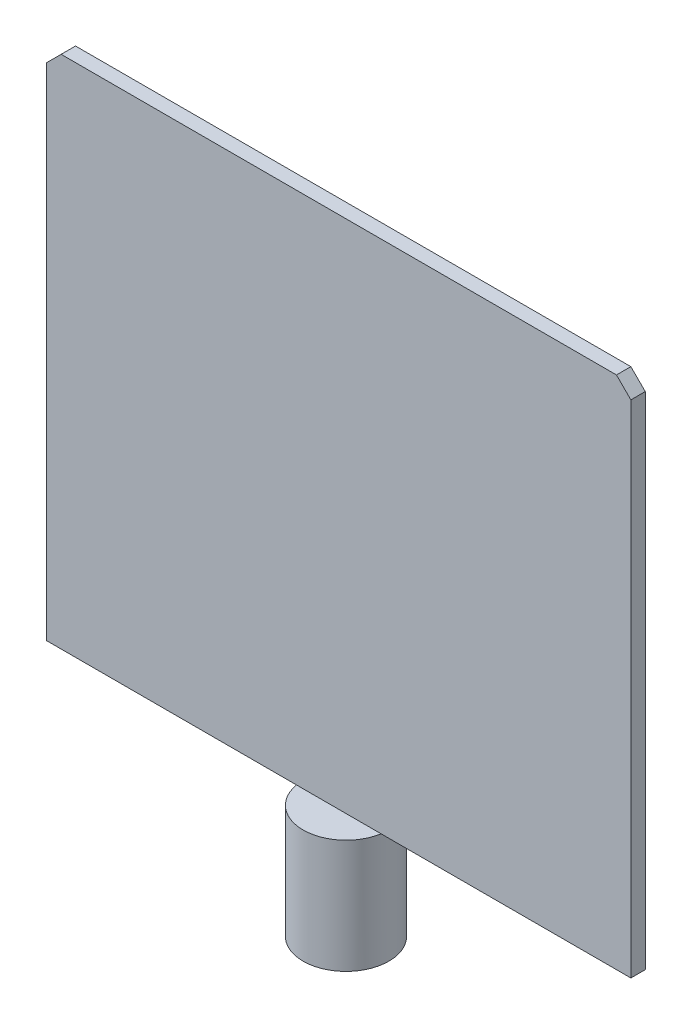
from build123d import *

# Parameters (mm, degrees)
ESQUISSE2_R             = 2.98
BOSS_EXTRU_1_DEPTH      = 7.9
BOSS_EXTRU_2_DEPTH      = 0.5
BOSS_EXTRU_2_DEPTH_BACK = 0.5
ESQUISSE3_W             = 40.6
ESQUISSE3_H             = 35.8
CHANFREIN1_SIZE         = 1


with BuildPart() as part:
    # Esquisse2 → Boss.-Extru.1 (new body)
    with BuildSketch(Plane(origin=(0, 0, 0), x_dir=(1, 0, 0), z_dir=(0, 1, 0))):
        Circle(ESQUISSE2_R)
    extrude(amount=-BOSS_EXTRU_1_DEPTH)

    # Esquisse3 → Boss.-Extru.2 (add, two sides: drawn at the far end of the back side and taken through both)
    with BuildSketch(Plane.XY.offset(-BOSS_EXTRU_2_DEPTH_BACK)):
        with Locations((0, 17.9)):
            Rectangle(ESQUISSE3_W, ESQUISSE3_H)
    extrude(amount=BOSS_EXTRU_2_DEPTH + BOSS_EXTRU_2_DEPTH_BACK)

    # Chanfrein1
    chanfrein1_edges = [part.edges().sort_by_distance(p)[0] for p in [
        (-20.3, 35.8, 0),
        (20.3, 35.8, 0),
    ]]
    chamfer(chanfrein1_edges, length=CHANFREIN1_SIZE)


solid = part.part
